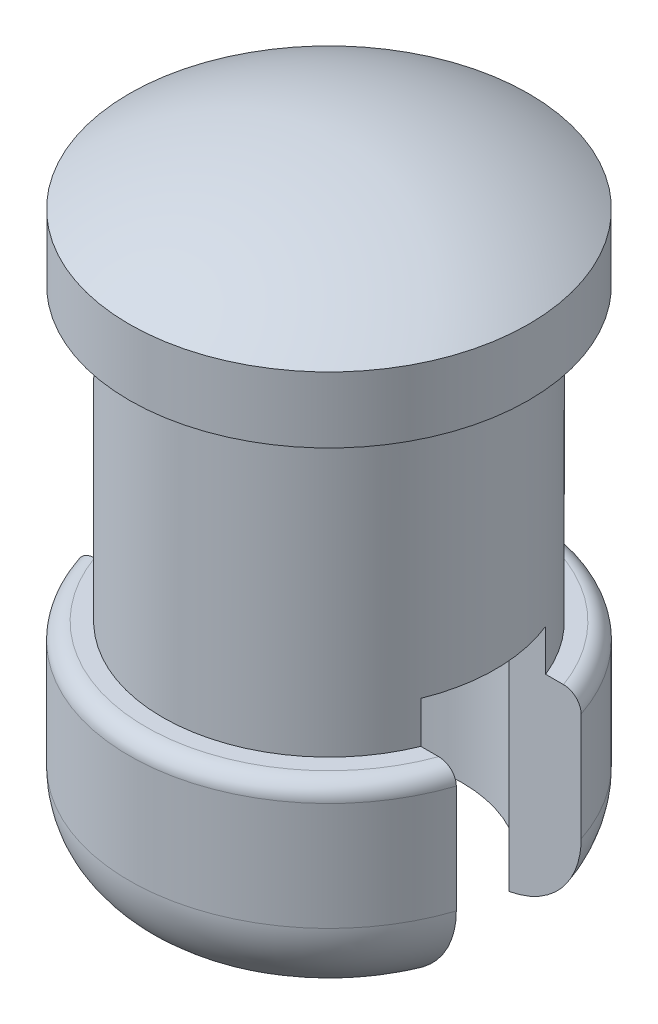
from build123d import *

# Parameters (mm, degrees)
SKETCH_4_R          = 1.6
CUT_EXTRUDE_1_DEPTH = 6
SKETCH_5_W          = 6.845786851
SKETCH_5_H          = 1.5
CUT_EXTRUDE_3_DEPTH = 3


with BuildPart() as part:
    # 草图3 → 旋转1 (revolve)
    with BuildSketch(Plane(origin=(0, 0, 0), x_dir=(0, 0, -1), z_dir=(1, 0, 0)), mode=Mode.PRIVATE) as revolve_1_sk:
        with BuildLine():
            Line((2.4, 6.791402502), (2.4, 6))
            Line((2.4, 6), (2, 6))
            Line((2, 6), (2, 2.5))
            Line((2, 2.5), (2.2, 2.5))
            ThreePointArc((2.2, 2.5), (2.341421356, 2.441421356), (2.4, 2.3))
            Line((2.4, 2.3), (2.4, 1))
            ThreePointArc((2.4, 1), (2.107106781, 0.292893219), (1.4, 0))
            Line((1.4, 0), (0, 0))
            Line((0, 0), (0, 7.5))
            ThreePointArc((0, 7.5), (1.251210455, 7.319149638), (2.4, 6.791402502))
        make_face()
    revolve(revolve_1_sk.sketch.rotate(Axis((0, 28.211895781, 0), (0, -1, 0)), 180), axis=Axis((0, 28.211895781, 0), (0, -1, 0)))

    # 草图4 → 切除-拉伸1 (cut)
    with BuildSketch(Plane.XZ):
        with Locations(Location((0, 0, 0), (0, 0, 270))):
            Circle(SKETCH_4_R)
    extrude(amount=-CUT_EXTRUDE_1_DEPTH, mode=Mode.SUBTRACT)

    # 草图5 → 切除-拉伸3 (cut)
    with BuildSketch(Plane(origin=(0, 0, 0), x_dir=(1, 0, 0), z_dir=(0, 1, 0))):
        with Locations((0.068457868, 0)):
            Rectangle(SKETCH_5_W, SKETCH_5_H)
    extrude(amount=CUT_EXTRUDE_3_DEPTH, mode=Mode.SUBTRACT)


solid = part.part
